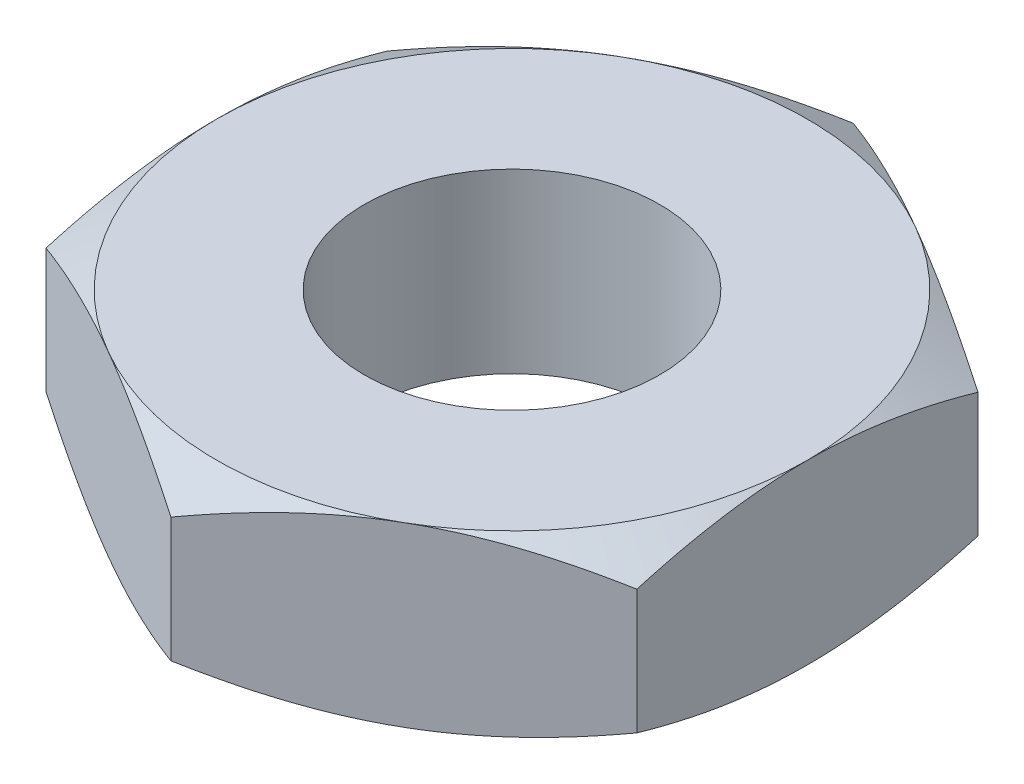
from build123d import *

# Parameters (mm, degrees)
SKETCH1_R               = 1
BOSS_EXTRUDE1_DEPTH     = 0.6
SKETCH5_OUTSIDE_W       = 22.08
SKETCH5_OUTSIDE_H       = 22.698
SKETCH5_OUTSIDE_R       = 2
CUT_EXTRUDE2_DEPTH      = 4.282275633
CUT_EXTRUDE2_DRAFT      = -60
MIRROR1_COPY_1_SKETCH_W = 22.08
MIRROR1_COPY_1_SKETCH_H = 22.698
MIRROR1_COPY_1_SKETCH_R = 2
MIRROR1_COPY_1_DEPTH    = 4.282275633
MIRROR1_COPY_1_DRAFT    = -60


with BuildPart() as part:
    # Sketch1 → Boss-Extrude1 (new, symmetric)
    with BuildSketch(Plane(origin=(0, 0, 0), x_dir=(1, 0, 0), z_dir=(0, 1, 0))):
        Polygon((-2, 1.154700538), (-2, -1.154700538), (0, -2.309401077), (2, -1.154700538), (2, 1.154700538), (0, 2.309401077), align=None)
        Circle(SKETCH1_R, mode=Mode.SUBTRACT)
    extrude(amount=BOSS_EXTRUDE1_DEPTH, both=True)


with BuildPart() as cut_extrude2_tool:
    # Sketch5 outside → Cut-Extrude2 (with draft: the straight prism first)
    with BuildSketch(Plane(origin=(0, 0.6, 0), x_dir=(1, 0, 0), z_dir=(0, 1, 0))):
        Rectangle(SKETCH5_OUTSIDE_W, SKETCH5_OUTSIDE_H)
        Circle(SKETCH5_OUTSIDE_R, mode=Mode.SUBTRACT)
    extrude(amount=-CUT_EXTRUDE2_DEPTH)
    # Cut-Extrude2: the draft: its side faces are tilted about the plane it starts from
    cut_extrude2_sides = [cut_extrude2_tool.faces().sort_by_distance(p)[0] for p in [
        (0, -1.541137817, 11.349),
        (11.04, -1.541137817, 0),
        (0, -1.541137817, -11.349),
        (-11.04, -1.541137817, 0),
        (-2, -1.541137817, 0),
    ]]
    draft(cut_extrude2_sides, Plane(origin=(0, 0.6, 0), x_dir=(1, 0, 0), z_dir=(0, 1, 0)), CUT_EXTRUDE2_DRAFT)


with BuildPart() as part_1:
    add(part.part)

    # Cut-Extrude2: cut by cut_extrude2_tool
    add(cut_extrude2_tool.part, mode=Mode.SUBTRACT)


with BuildPart() as mirror1_copy_1_tool:
    # Mirror1 copy 1 sketch → Mirror1 copy 1 (with draft: the straight prism first)
    with BuildSketch(Plane.XZ.offset(0.6)):
        Rectangle(MIRROR1_COPY_1_SKETCH_W, MIRROR1_COPY_1_SKETCH_H)
        Circle(MIRROR1_COPY_1_SKETCH_R, mode=Mode.SUBTRACT)
    extrude(amount=-MIRROR1_COPY_1_DEPTH)
    # Mirror1 copy 1: the draft: its side faces are tilted about the plane it starts from
    mirror1_copy_1_sides = [mirror1_copy_1_tool.faces().sort_by_distance(p)[0] for p in [
        (0, 1.541137817, 11.349),
        (11.04, 1.541137817, 0),
        (0, 1.541137817, -11.349),
        (-11.04, 1.541137817, 0),
        (-2, 1.541137817, 0),
    ]]
    draft(mirror1_copy_1_sides, Plane.XZ.offset(0.6), MIRROR1_COPY_1_DRAFT)


with BuildPart() as part_2:
    add(part_1.part)

    # Mirror1 copy 1: cut by mirror1_copy_1_tool
    add(mirror1_copy_1_tool.part, mode=Mode.SUBTRACT)


solid = part_2.part
